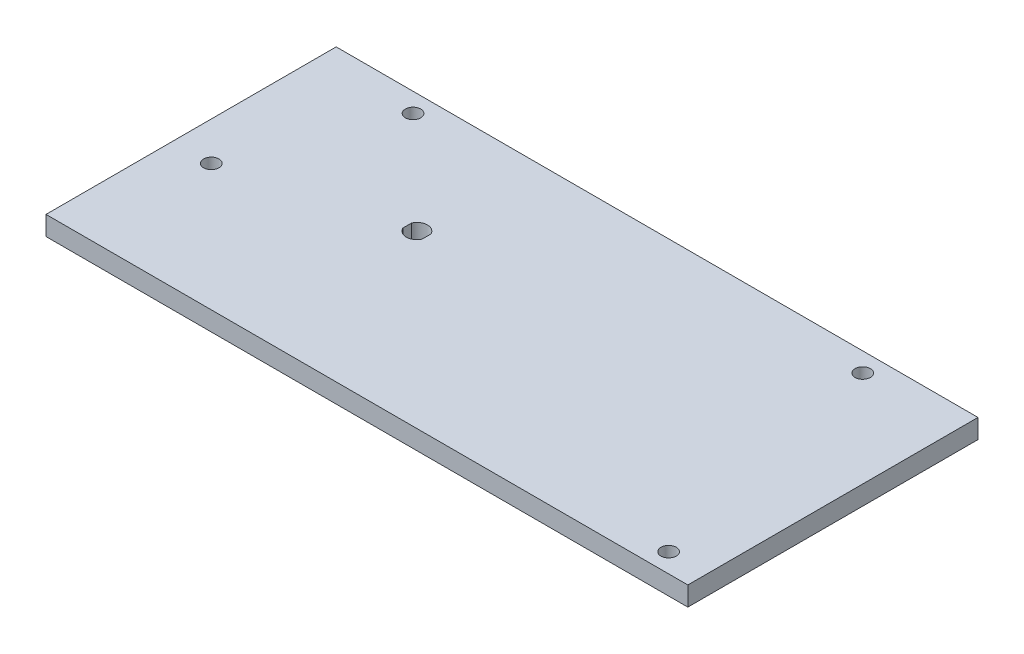
from build123d import *

# Parameters (mm, degrees)
SKETCH2_W           = 167
SKETCH2_H           = 75.5
SKETCH2_R           = 2
BOSS_EXTRUDE1_DEPTH = 5
CUT_EXTRUDE1_DEPTH  = 92.77315784


with BuildPart() as part:
    # Sketch2 → Boss-Extrude1 (new body)
    with BuildSketch(Plane(origin=(0, 0, 0), x_dir=(1, 0, 0), z_dir=(0, 1, 0))):
        Rectangle(SKETCH2_W, SKETCH2_H)
        with Locations(Location((-58.5, 32.75, 0), (0, 0, 270))):
            Circle(SKETCH2_R, mode=Mode.SUBTRACT)
        with Locations(Location((58.5, 32.75, 0), (0, 0, 270))):
            Circle(SKETCH2_R, mode=Mode.SUBTRACT)
        with Locations(Location((-73.5, -4.75, 0), (0, 0, 270))):
            Circle(SKETCH2_R, mode=Mode.SUBTRACT)
        with Locations(Location((73.5, -32.75, 0), (0, 0, 270))):
            Circle(SKETCH2_R, mode=Mode.SUBTRACT)
    extrude(amount=BOSS_EXTRUDE1_DEPTH)

    # Sketch3 → Cut-Extrude1 (cut, through all)
    with BuildSketch(Plane(origin=(0, 5, 0), x_dir=(1, 0, 0), z_dir=(0, 1, 0))):
        with BuildLine():
            ThreePointArc((-29, 7.895643924), (-31.5, 9.5), (-34, 7.895643924))
            Line((-34, 7.895643924), (-34, 5.604356076))
            ThreePointArc((-34, 5.604356076), (-31.5, 4), (-29, 5.604356076))
            Line((-29, 5.604356076), (-29, 7.895643924))
        make_face()
    extrude(amount=-CUT_EXTRUDE1_DEPTH, mode=Mode.SUBTRACT)


solid = part.part
